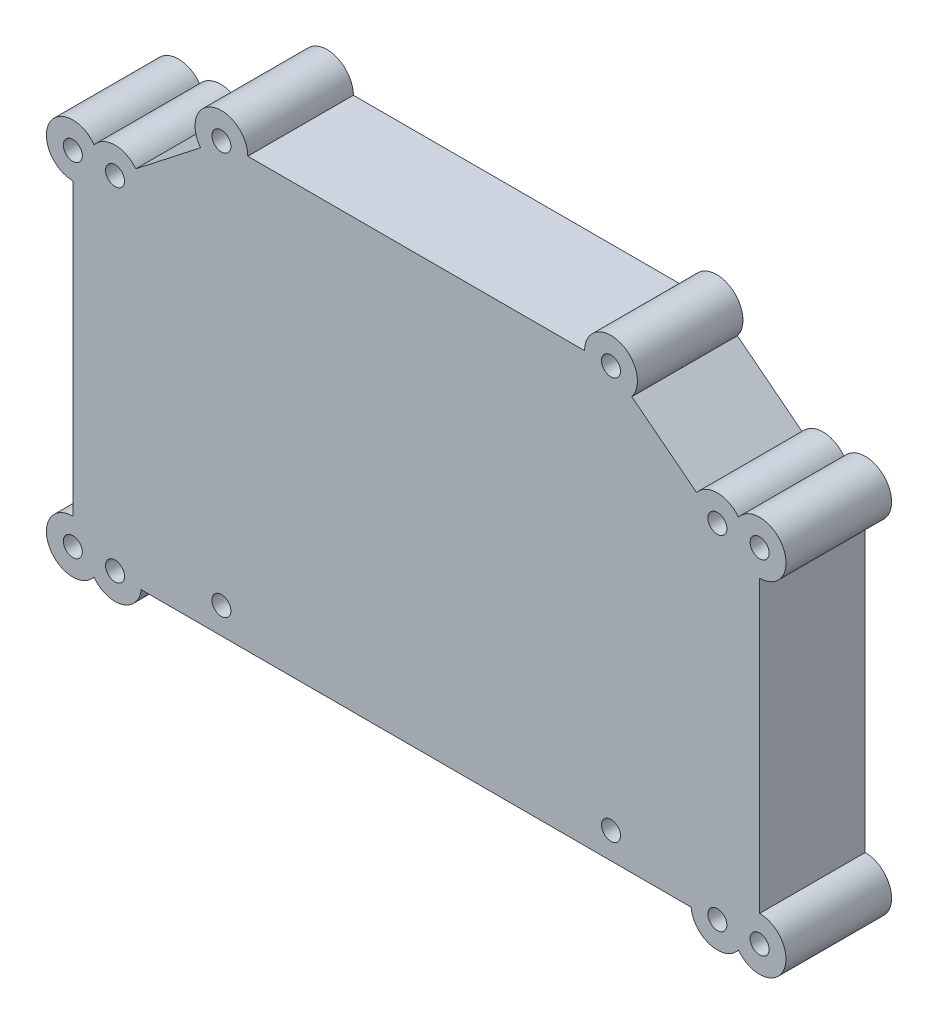
from build123d import *

# Parameters (mm, degrees)
SKETCH2_R           = 1.8
BOSS_EXTRUDE1_DEPTH = 20


with BuildPart() as part:
    # Sketch2 → Boss-Extrude1 (new body)
    with BuildSketch(Plane.XY):
        with BuildLine():
            ThreePointArc((-60.998373194, 25.417629235), (-69.501790799, 24.76016427), (-65.048841754, 17.486127155))
            Line((-65.048841754, 17.486127155), (-65.05, -37.513872835))
            ThreePointArc((-65.05, -37.513872835), (-69.522135955, -44.749940812), (-61.05, -45.513872835))
            ThreePointArc((-61.05, -45.513872835), (-55.750093871, -47.341941191), (-52.084473347, -43.1))
            Line((-52.084473347, -43.1), (-36.9, -43.1))
            Line((-36.9, -43.1), (36.9, -43.1))
            Line((36.9, -43.1), (52.070291173, -43.1))
            ThreePointArc((52.070291173, -43.1), (55.684136776, -47.459825117), (61.05, -45.65))
            ThreePointArc((61.05, -45.65), (69.522135955, -44.886067977), (65.05, -37.65))
            Line((65.05, -37.65), (65.05, 17.35))
            ThreePointArc((65.05, 17.35), (69.522135955, 24.586067977), (61.05, 25.35))
            ThreePointArc((61.05, 25.35), (57.099855684, 27.349751435), (53.110619235, 25.429168588))
            Line((53.110619235, 25.429168588), (40.839380765, 35.020831412))
            ThreePointArc((40.839380765, 35.020831412), (38.528357482, 42.827414929), (31.9, 38.1))
            Line((31.9, 38.1), (-31.9, 38.1))
            ThreePointArc((-31.9, 38.1), (-38.528357482, 42.827414929), (-40.839380765, 35.020831412))
            Line((-40.839380765, 35.020831412), (-53.110619235, 25.429168588))
            ThreePointArc((-53.110619235, 25.429168588), (-57.057314719, 27.349994649), (-60.998373194, 25.417629235))
        make_face()
        with Locations((-65.05, -42.513872835)):
            Circle(SKETCH2_R, mode=Mode.SUBTRACT)
        with Locations((-57.05, -42.513872835)):
            Circle(SKETCH2_R, mode=Mode.SUBTRACT)
        with Locations((-36.9, -38.1)):
            Circle(SKETCH2_R, mode=Mode.SUBTRACT)
        with Locations((36.9, -38.1)):
            Circle(SKETCH2_R, mode=Mode.SUBTRACT)
        with Locations((57.05, -42.65)):
            Circle(SKETCH2_R, mode=Mode.SUBTRACT)
        with Locations((65.05, -42.65)):
            Circle(SKETCH2_R, mode=Mode.SUBTRACT)
        with Locations((-65.048841754, 22.486127155)):
            Circle(SKETCH2_R, mode=Mode.SUBTRACT)
        with Locations((-57.05, 22.35)):
            Circle(SKETCH2_R, mode=Mode.SUBTRACT)
        with Locations((-36.9, 38.1)):
            Circle(SKETCH2_R, mode=Mode.SUBTRACT)
        with Locations((57.05, 22.35)):
            Circle(SKETCH2_R, mode=Mode.SUBTRACT)
        with Locations((65.05, 22.35)):
            Circle(SKETCH2_R, mode=Mode.SUBTRACT)
        with Locations((36.9, 38.1)):
            Circle(SKETCH2_R, mode=Mode.SUBTRACT)
    extrude(amount=BOSS_EXTRUDE1_DEPTH)


solid = part.part
